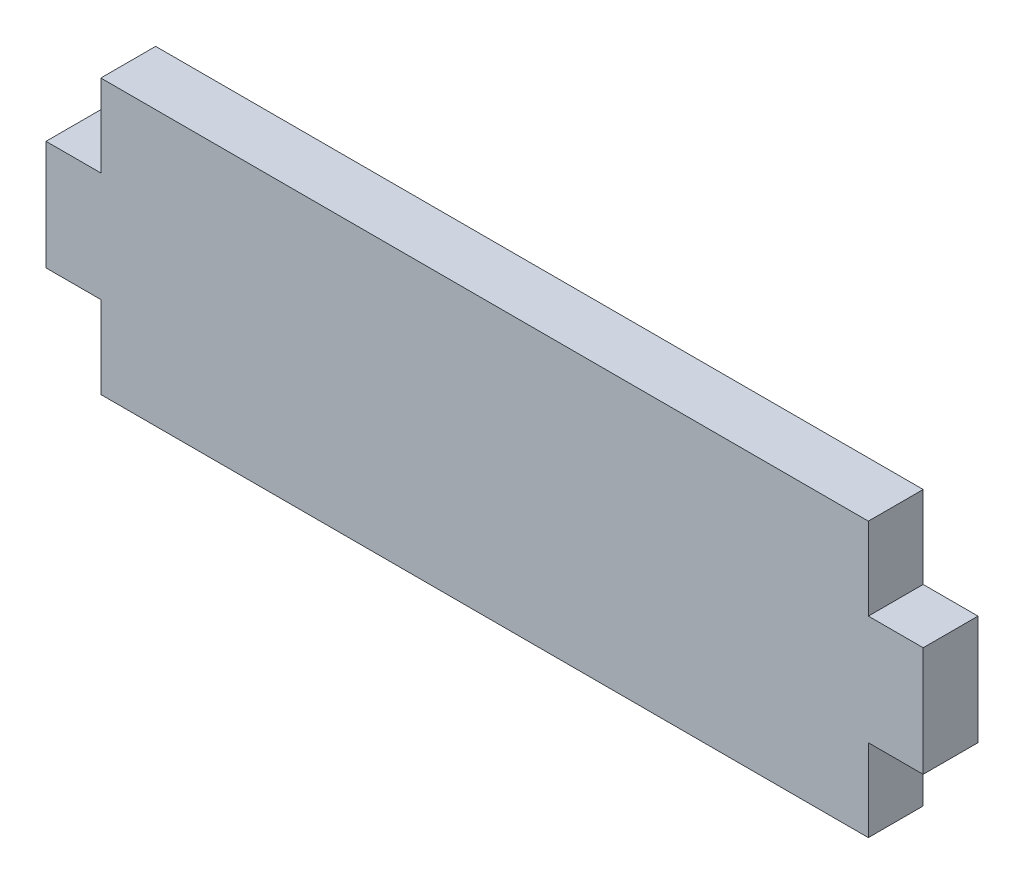
from build123d import *

# Parameters (mm, degrees)
EXTRUDE_1_DEPTH = 5


with BuildPart() as part:
    # 스케치1 → 보스-돌출1 (new body)
    with BuildSketch(Plane.XY):
        Polygon((-40, 5), (-40, -5), (-35, -5), (-35, -12.5), (35, -12.5), (35, -5), (40, -5), (40, 5), (35, 5), (35, 12.5), (-35, 12.5), (-35, 5), align=None)
    extrude(amount=EXTRUDE_1_DEPTH)


solid = part.part
